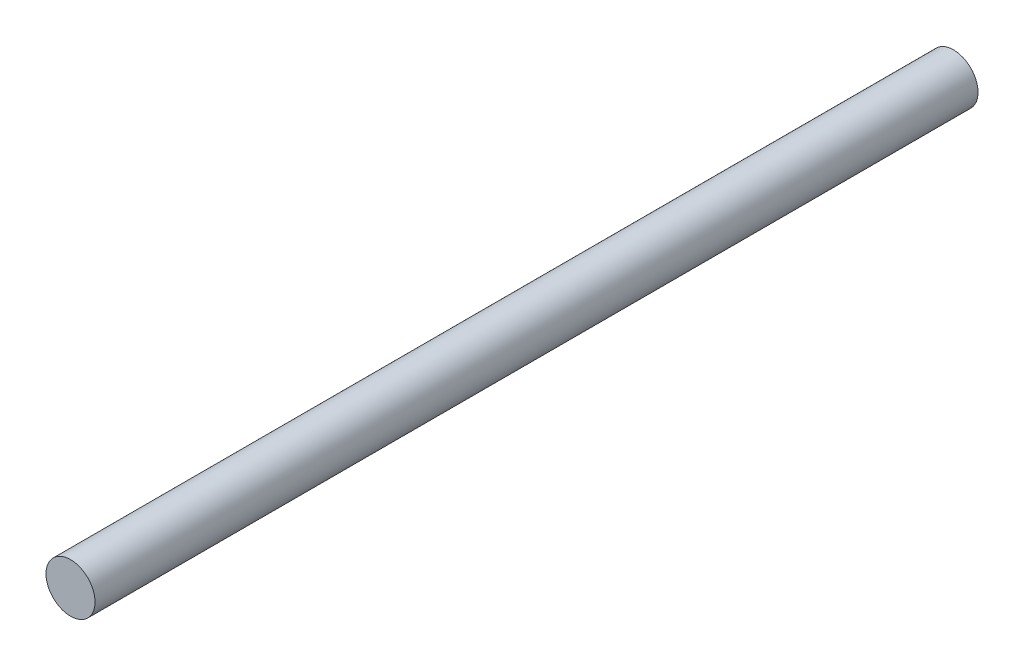
from build123d import *

# Parameters (mm, degrees)
SKETCH1_R           = 5
BOSS_EXTRUDE1_DEPTH = 180


with BuildPart() as part:
    # Sketch1 → Boss-Extrude1 (new body)
    with BuildSketch(Plane.XY):
        with Locations(Location((0, 0, 0), (0, 0, 180))):
            Circle(SKETCH1_R)
    extrude(amount=BOSS_EXTRUDE1_DEPTH)


solid = part.part
